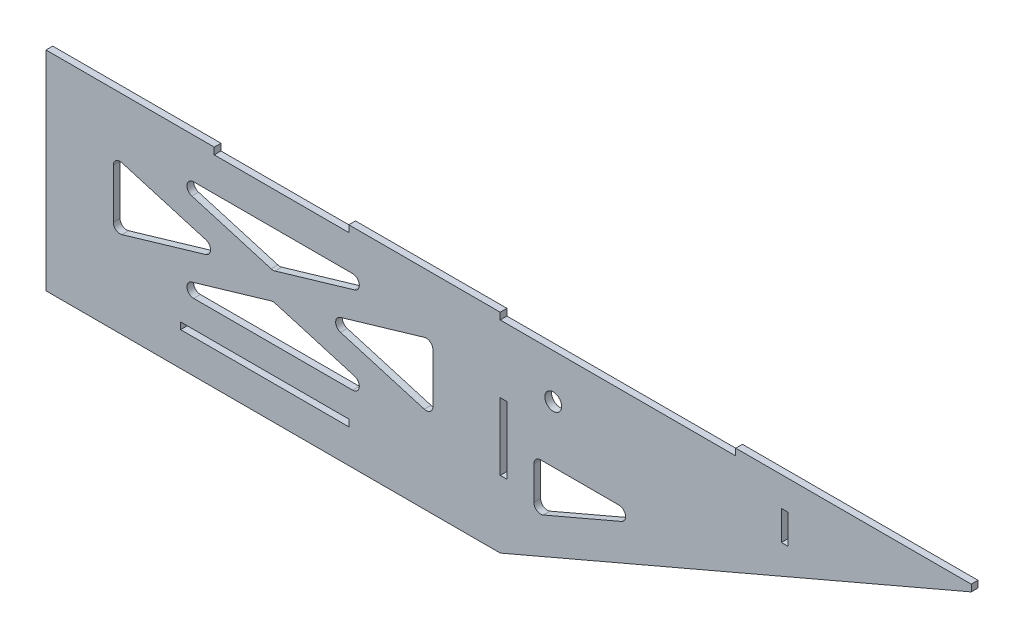
from build123d import *

# Parameters (mm, degrees)
SKETCH_1_W      = 135
SKETCH_1_H      = 60.000000048
SKETCH_1_W_2    = 50
SKETCH_1_H_2    = 2
SKETCH_1_R      = 2.5
SKETCH_1_W_3    = 45
SKETCH_1_H_3    = 2.000000262
SKETCH_1_W_4    = 70.000000056
EXTRUDE_1_DEPTH = 2


with BuildPart() as part:
    # 草图1 → 凸台-拉伸1 (new body)
    # profile 1 of 5: a face of its own
    with BuildSketch(Plane.XY):
        with Locations((67.5, -2.86e-07)):
            Rectangle(SKETCH_1_W, SKETCH_1_H)
        with BuildLine():
            ThreePointArc((68.064332648, 0.863431574), (67.5, 0.944700571), (66.935667352, 0.863431574))
            Line((66.935667352, 0.863431574), (43.323685411, -6.081268997))
            ThreePointArc((43.323685411, -6.081268997), (41.908439567, -8.285077177), (43.888018059, -10))
            Line((43.888018059, -10), (91.111981941, -10))
            ThreePointArc((91.111981941, -10), (93.091560433, -8.285077177), (91.676314589, -6.081268997))
            Line((91.676314589, -6.081268997), (68.064332648, 0.863431574))
        make_face(mode=Mode.SUBTRACT)
        with BuildLine():
            ThreePointArc((66.935667352, 9.136568426), (67.5, 9.055299429), (68.064332648, 9.136568426))
            Line((68.064332648, 9.136568426), (91.676314589, 16.081268997))
            ThreePointArc((91.676314589, 16.081268997), (93.091560433, 18.285077177), (91.111981941, 20))
            Line((91.111981941, 20), (43.888018059, 20))
            ThreePointArc((43.888018059, 20), (41.908439567, 18.285077177), (43.323685411, 16.081268997))
            Line((43.323685411, 16.081268997), (66.935667352, 9.136568426))
        make_face(mode=Mode.SUBTRACT)
        with Locations((65, -19)):
            Rectangle(SKETCH_1_W_2, SKETCH_1_H_2, mode=Mode.SUBTRACT)
        with BuildLine():
            Line((47.476314589, 3.081268997), (22.564332648, -4.245784515))
            ThreePointArc((22.564332648, -4.245784515), (20.80180663, -3.928406892), (20, -2.327053512))
            Line((20, -2.327053512), (20, 12.327053512))
            ThreePointArc((20, 12.327053512), (20.80180663, 13.928406892), (22.564332648, 14.245784515))
            Line((22.564332648, 14.245784515), (47.476314589, 6.918731003))
            ThreePointArc((47.476314589, 6.918731003), (48.911981941, 5), (47.476314589, 3.081268997))
        make_face(mode=Mode.SUBTRACT)
        with BuildLine():
            Line((87.523685411, 3.081268997), (112.435667352, -4.245784515))
            ThreePointArc((112.435667352, -4.245784515), (114.19819337, -3.928406892), (115, -2.327053512))
            Line((115, -2.327053512), (115, 12.327053512))
            ThreePointArc((115, 12.327053512), (114.19819337, 13.928406892), (112.435667352, 14.245784515))
            Line((112.435667352, 14.245784515), (87.523685411, 6.918731003))
            ThreePointArc((87.523685411, 6.918731003), (86.088018059, 5), (87.523685411, 3.081268997))
        make_face(mode=Mode.SUBTRACT)
    # profile 2 of 5: a face of its own
    with BuildSketch(Plane.XY):
        Polygon((135, -10), (135, -30.00000031), (275.000000112, 29.999999738), (205.000000056, 29.999999738), (135, 29.999999738), (135, 10), (137, 10), (137, -10), align=None)
        with BuildLine():
            Line((171.04398986, -3.83829006), (147.787838597, -13.80521203))
            ThreePointArc((147.787838597, -13.80521203), (145.899017983, -13.636604154), (145, -11.96692197))
            Line((145, -11.96692197), (145, -2))
            ThreePointArc((145, -2), (145.585786438, -0.585786438), (147, 0))
            Line((147, 0), (170.256151263, 0))
            ThreePointArc((170.256151263, 0), (172.215306708, -1.597868255), (171.04398986, -3.83829006))
        make_face(mode=Mode.SUBTRACT)
        with Locations((150.760493498, 16.868933163)):
            Circle(SKETCH_1_R, mode=Mode.SUBTRACT)
        Polygon((218.565739708, 14.508933163), (218.565739708, 16.868933163), (218.565739708, 23.287933163), (220.565739708, 23.287933163), (220.565739708, 14.508933163), align=None, mode=Mode.SUBTRACT)
    # profile 3 of 5: a face of its own
    with BuildSketch(Plane.XY):
        with Locations((112.5, 30.999999869)):
            Rectangle(SKETCH_1_W_3, SKETCH_1_H_3)
    # profile 4 of 5: a face of its own
    with BuildSketch(Plane.XY):
        with Locations((25, 30.999999869)):
            Rectangle(SKETCH_1_W_2, SKETCH_1_H_3)
    # profile 5 of 5: a face of its own
    with BuildSketch(Plane.XY):
        with Locations((240.000000084, 30.999999869)):
            Rectangle(SKETCH_1_W_4, SKETCH_1_H_3)
    extrude(amount=EXTRUDE_1_DEPTH)


solid = part.part
